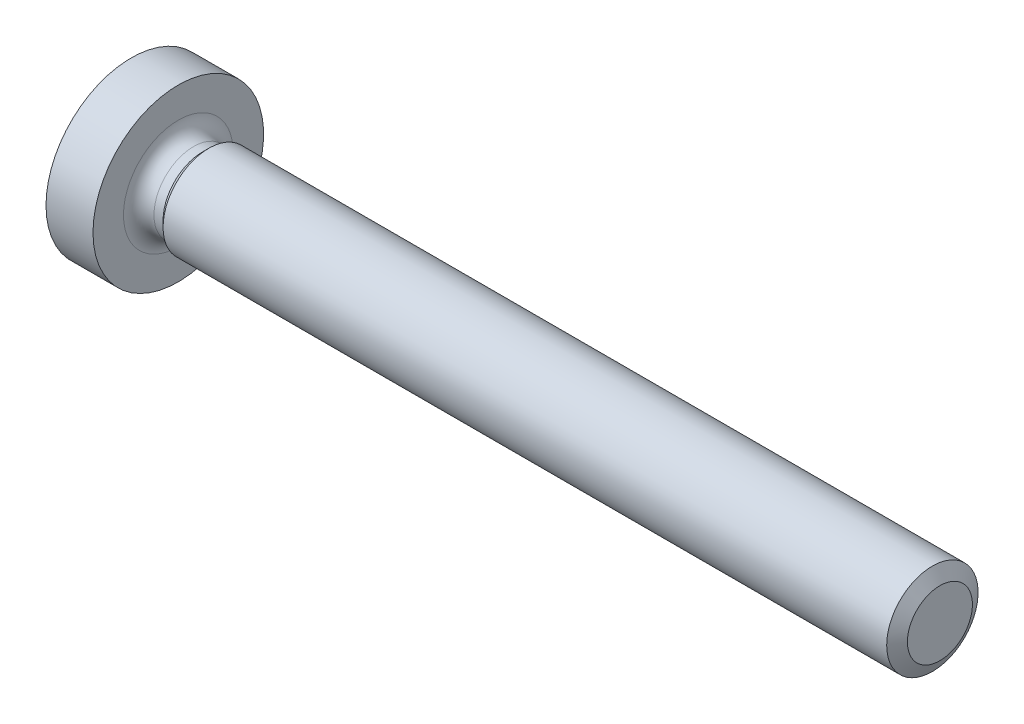
from build123d import *


with BuildPart() as part:
    # 草图2 → Revolve 816 (revolve)
    with BuildSketch(Plane.XY, mode=Mode.PRIVATE) as revolve_816_sk:
        with BuildLine():
            Line((0, 0), (27.4, 0))
            Line((27.4, 0), (27.4, 1.5))
            Line((27.4, 1.5), (3.4, 1.5))
            Line((3.4, 1.5), (3.199, 1.299))
            Line((3.199, 1.299), (2.901, 1.299))
            ThreePointArc((2.901, 1.299), (2.546739503, 1.445739503), (2.4, 1.8))
            Line((2.4, 1.8), (2.4, 2.8))
            Line((2.4, 2.8), (0.857536965, 2.8))
            ThreePointArc((0.857536965, 2.8), (0.219188606, 1.464186604), (0, 0))
        make_face()
    revolve(revolve_816_sk.sketch.rotate(Axis((-1.331757704, 0, 0), (1, 0, 0)), 90), axis=Axis((-1.331757704, 0, 0), (1, 0, 0)))

    # 草图3 → 切除-旋转1 (revolve, cut)
    with BuildSketch(Plane.XY, mode=Mode.PRIVATE) as cut_revolve_1_sk:
        Polygon((27.152708003, 1.5), (27.652708003, 1.5), (27.4, 1.067), align=None)
    revolve(cut_revolve_1_sk.sketch.rotate(Axis((-0.242766179, 0, 0), (1, 0, 0)), 90), axis=Axis((-0.242766179, 0, 0), (1, 0, 0)), mode=Mode.SUBTRACT)

    # 草图5 → 切除-放样1 section 0
    with BuildSketch(Plane(origin=(0, 0, 0), x_dir=(0, 0, -1), z_dir=(1, 0, 0)), mode=Mode.PRIVATE) as loft_1_s0:
        with BuildLine():
            Line((0.25, 1.5), (-0.25, 1.5))
            Line((-0.25, 1.5), (-0.25, -1.5))
            Line((-0.25, -1.5), (0.25, -1.5))
            Line((0.25, -1.5), (0.25, 1.5))
        make_face()
    loft_1 = loft([Vertex(1.8, 0, 0), loft_1_s0.sketch], mode=Mode.SUBTRACT)

    # 镜向1: 切除-放样1 across plane
    add(loft_1.mirror(Plane(origin=(0, 0, 0), x_dir=(0, 0.7071067811865462, 0.7071067811865488), z_dir=(0, -0.7071067811865488, 0.7071067811865462))), mode=Mode.SUBTRACT)


solid = part.part
